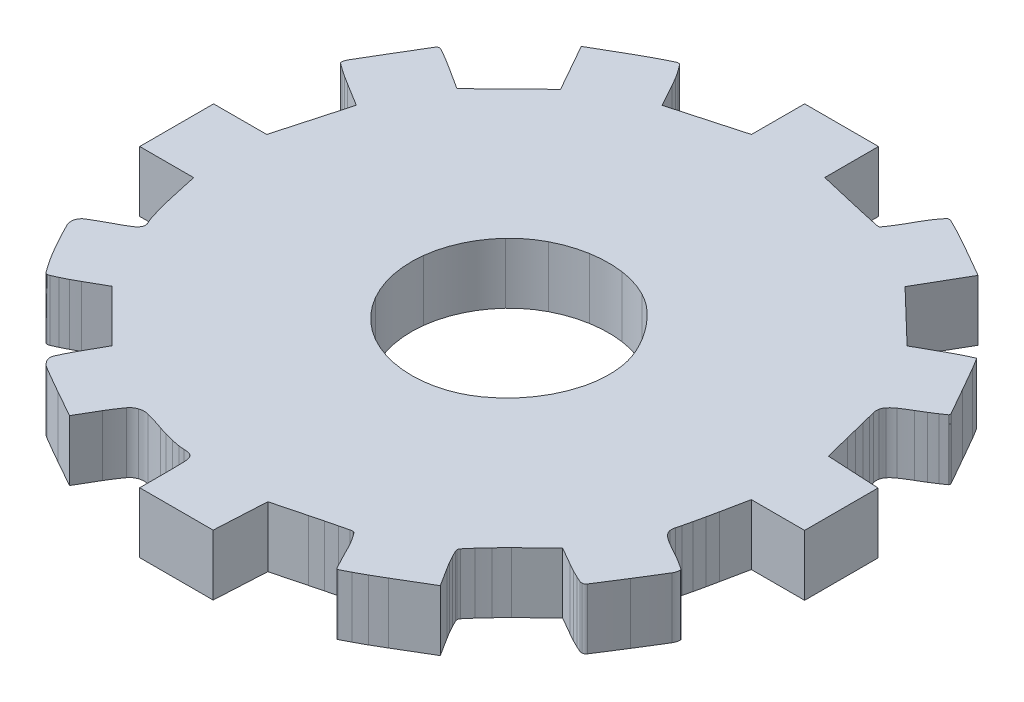
from build123d import *

# Parameters (mm, degrees)
BOSS_EXTRUDE1_DEPTH = 1
SCALE1_SCALE        = 18


with BuildPart() as part:
    # Sketch1 → Boss-Extrude1 (new body)
    with BuildSketch(Plane(origin=(0, 0, 0), x_dir=(1, 0, 0), z_dir=(0, 1, 0))):
        with BuildLine():
            Line((14951.934815684, 3224.873667402), (14951.934288838, 3224.435517402))
            Line((14951.934288838, 3224.435517402), (14951.357048235, 3224.275253181))
            Line((14951.357048235, 3224.275253181), (14950.779807631, 3224.11498896))
            Line((14950.779807631, 3224.11498896), (14950.576525081, 3224.483705292))
            ThreePointArc((14950.576525081, 3224.483705292), (14950.536206031, 3224.554865199), (14950.494241807, 3224.625067493))
            ThreePointArc((14950.494241807, 3224.625067493), (14950.455742563, 3224.685434793), (14950.415177449, 3224.744433726))
            ThreePointArc((14950.415177449, 3224.744433726), (14950.380816699, 3224.791350253), (14950.345294048, 3224.837393307))
            ThreePointArc((14950.345294048, 3224.837393307), (14950.330815109, 3224.849111812), (14950.312717176, 3224.853519513))
            ThreePointArc((14950.312717176, 3224.853519513), (14950.291892949, 3224.851425913), (14950.272140143, 3224.844507948))
            ThreePointArc((14950.272140143, 3224.844507948), (14950.198863614, 3224.808265842), (14950.125886435, 3224.771424681))
            ThreePointArc((14950.125886435, 3224.771424681), (14950.039615247, 3224.726613358), (14949.954022669, 3224.680519071))
            ThreePointArc((14949.954022669, 3224.680519071), (14949.857580123, 3224.627005112), (14949.761690821, 3224.572506029))
            Line((14949.761690821, 3224.572506029), (14949.271189897, 3224.290394655))
            Line((14949.271189897, 3224.290394655), (14949.49274955, 3223.897812636))
            Line((14949.49274955, 3223.897812636), (14949.714309127, 3223.505230541))
            Line((14949.714309127, 3223.505230541), (14949.281775829, 3223.082790466))
            Line((14949.281775829, 3223.082790466), (14948.849242531, 3222.660350315))
            Line((14948.849242531, 3222.660350315), (14948.506342531, 3222.879744898))
            ThreePointArc((14948.506342531, 3222.879744898), (14948.439364248, 3222.92215023), (14948.371984558, 3222.963914808))
            ThreePointArc((14948.371984558, 3222.963914808), (14948.312316169, 3222.999934458), (14948.252149237, 3223.035115022))
            ThreePointArc((14948.252149237, 3223.035115022), (14948.20110897, 3223.06423282), (14948.149856528, 3223.09297551))
            ThreePointArc((14948.149856528, 3223.09297551), (14948.136640581, 3223.098398183), (14948.12252275, 3223.100578442))
            ThreePointArc((14948.12252275, 3223.100578442), (14948.097800986, 3223.094773131), (14948.079433631, 3223.077237239))
            ThreePointArc((14948.079433631, 3223.077237239), (14947.941477447, 3222.847879973), (14947.804090951, 3222.618181007))
            ThreePointArc((14947.804090951, 3222.618181007), (14947.671209776, 3222.394338), (14947.539254651, 3222.169947842))
            ThreePointArc((14947.539254651, 3222.169947842), (14947.521724795, 3222.128153776), (14947.515742531, 3222.083228813))
            ThreePointArc((14947.515742531, 3222.083228813), (14947.518456442, 3222.071834682), (14947.526015358, 3222.062887375))
            ThreePointArc((14947.526015358, 3222.062887375), (14947.575079119, 3222.02704536), (14947.624468349, 3221.991653177))
            ThreePointArc((14947.624468349, 3221.991653177), (14947.683830394, 3221.950410107), (14947.744005346, 3221.910362407))
            ThreePointArc((14947.744005346, 3221.910362407), (14947.814651655, 3221.864999938), (14947.885873058, 3221.820545848))
            Line((14947.885873058, 3221.820545848), (14948.256003509, 3221.59280226))
            Line((14948.256003509, 3221.59280226), (14948.095423058, 3221.014436716))
            Line((14948.095423058, 3221.014436716), (14947.934842531, 3220.436071096))
            Line((14947.934842531, 3220.436071096), (14947.496692531, 3220.435544249))
            Line((14947.496692531, 3220.435544249), (14947.058542531, 3220.435017402))
            Line((14947.058542531, 3220.435017402), (14947.058542531, 3219.825417402))
            Line((14947.058542531, 3219.825417402), (14947.058542531, 3219.215817402))
            Line((14947.058542531, 3219.215817402), (14947.503616825, 3219.215817402))
            Line((14947.503616825, 3219.215817402), (14947.948691119, 3219.215817402))
            Line((14947.948691119, 3219.215817402), (14948.045749879, 3218.777667402))
            ThreePointArc((14948.045749879, 3218.777667402), (14948.06616249, 3218.688824183), (14948.087965745, 3218.600311979))
            ThreePointArc((14948.087965745, 3218.600311979), (14948.110521759, 3218.514818592), (14948.134543453, 3218.429725401))
            ThreePointArc((14948.134543453, 3218.429725401), (14948.156282595, 3218.357367129), (14948.1791949, 3218.28537174))
            ThreePointArc((14948.1791949, 3218.28537174), (14948.193847543, 3218.246231799), (14948.211730547, 3218.208458355))
            ThreePointArc((14948.211730547, 3218.208458355), (14948.225367279, 3218.173107775), (14948.230512857, 3218.135569169))
            ThreePointArc((14948.230512857, 3218.135569169), (14948.225570245, 3218.102675431), (14948.209976195, 3218.073294262))
            ThreePointArc((14948.209976195, 3218.073294262), (14948.177770194, 3218.038464444), (14948.139909761, 3218.009882451))
            ThreePointArc((14948.139909761, 3218.009882451), (14948.067433046, 3217.966457249), (14947.993447494, 3217.925655771))
            ThreePointArc((14947.993447494, 3217.925655771), (14947.818723411, 3217.830651355), (14947.64632129, 3217.731495657))
            ThreePointArc((14947.64632129, 3217.731495657), (14947.596478829, 3217.687216496), (14947.566909688, 3217.627462159))
            ThreePointArc((14947.566909688, 3217.627462159), (14947.561267534, 3217.560048582), (14947.580197292, 3217.495101768))
            ThreePointArc((14947.580197292, 3217.495101768), (14947.675763054, 3217.310568956), (14947.775250013, 3217.128120282))
            ThreePointArc((14947.775250013, 3217.128120282), (14947.830621055, 3217.031201193), (14947.887757256, 3216.935312108))
            ThreePointArc((14947.887757256, 3216.935312108), (14947.939220274, 3216.853321798), (14947.992957757, 3216.772803873))
            ThreePointArc((14947.992957757, 3216.772803873), (14948.038646058, 3216.707566634), (14948.085430267, 3216.643110788))
            ThreePointArc((14948.085430267, 3216.643110788), (14948.101209246, 3216.6297969), (14948.121293873, 3216.625017402))
            ThreePointArc((14948.121293873, 3216.625017402), (14948.141814103, 3216.627125585), (14948.161477029, 3216.633362064))
            ThreePointArc((14948.161477029, 3216.633362064), (14948.211691348, 3216.655640637), (14948.261539668, 3216.678726515))
            ThreePointArc((14948.261539668, 3216.678726515), (14948.321022555, 3216.707643012), (14948.379872477, 3216.737826854))
            ThreePointArc((14948.379872477, 3216.737826854), (14948.444156564, 3216.772330796), (14948.50788139, 3216.807857016))
            Line((14948.50788139, 3216.807857016), (14948.829776327, 3216.990696707))
            Line((14948.829776327, 3216.990696707), (14949.254426201, 3216.566046832))
            Line((14949.254426201, 3216.566046832), (14949.679076076, 3216.141396957))
            Line((14949.679076076, 3216.141396957), (14949.477284227, 3215.779970451))
            ThreePointArc((14949.477284227, 3215.779970451), (14949.408184726, 3215.648932998), (14949.345436205, 3215.514738444))
            ThreePointArc((14949.345436205, 3215.514738444), (14949.334074379, 3215.453412233), (14949.351150138, 3215.393425454))
            ThreePointArc((14949.351150138, 3215.393425454), (14949.395651288, 3215.333559955), (14949.454200046, 3215.287340118))
            ThreePointArc((14949.454200046, 3215.287340118), (14949.672387062, 3215.159368164), (14949.892132572, 3215.034091247))
            Line((14949.892132572, 3215.034091247), (14950.325422688, 3214.790593842))
            Line((14950.325422688, 3214.790593842), (14950.528023248, 3215.136305622))
            ThreePointArc((14950.528023248, 3215.136305622), (14950.602816566, 3215.256833017), (14950.683610846, 3215.373422801))
            ThreePointArc((14950.683610846, 3215.373422801), (14950.734983199, 3215.42446894), (14950.799628623, 3215.457115471))
            ThreePointArc((14950.799628623, 3215.457115471), (14950.873858162, 3215.46967157), (14950.948618368, 3215.46080637))
            ThreePointArc((14950.948618368, 3215.46080637), (14951.099992349, 3215.417209739), (14951.249542531, 3215.367717402))
            ThreePointArc((14951.249542531, 3215.367717402), (14951.317858019, 3215.344786398), (14951.38684472, 3215.32396161))
            ThreePointArc((14951.38684472, 3215.32396161), (14951.45890978, 3215.304479373), (14951.53148497, 3215.286993027))
            ThreePointArc((14951.53148497, 3215.286993027), (14951.597079518, 3215.273103839), (14951.66303665, 3215.261053481))
            ThreePointArc((14951.66303665, 3215.261053481), (14951.70857055, 3215.255329718), (14951.754422929, 3215.253417402))
            ThreePointArc((14951.754422929, 3215.253417402), (14951.806126607, 3215.249109792), (14951.856404665, 3215.236305778))
            ThreePointArc((14951.856404665, 3215.236305778), (14951.888057377, 3215.216992333), (14951.908754218, 3215.186226376))
            ThreePointArc((14951.908754218, 3215.186226376), (14951.924614851, 3215.133108571), (14951.931079751, 3215.078051637))
            ThreePointArc((14951.931079751, 3215.078051637), (14951.934276756, 3214.937150637), (14951.935342531, 3214.796217402))
            Line((14951.935342531, 3214.796217402), (14951.935342531, 3214.339017402))
            Line((14951.935342531, 3214.339017402), (14952.541139846, 3214.339017402))
            Line((14952.541139846, 3214.339017402), (14953.146937162, 3214.339017402))
            Line((14953.146937162, 3214.339017402), (14953.169789846, 3214.767500137))
            Line((14953.169789846, 3214.767500137), (14953.192642531, 3215.195982872))
            Line((14953.192642531, 3215.195982872), (14953.726042531, 3215.334607512))
            ThreePointArc((14953.726042531, 3215.334607512), (14953.83020187, 3215.361494781), (14953.934448998, 3215.388039638))
            ThreePointArc((14953.934448998, 3215.388039638), (14954.026714796, 3215.411139538), (14954.119089142, 3215.433801471))
            ThreePointArc((14954.119089142, 3215.433801471), (14954.197444941, 3215.452725557), (14954.275846943, 3215.471457302))
            ThreePointArc((14954.275846943, 3215.471457302), (14954.295326256, 3215.475298206), (14954.315043842, 3215.477624777))
            ThreePointArc((14954.315043842, 3215.477624777), (14954.331310855, 3215.474869962), (14954.344335046, 3215.464742024))
            ThreePointArc((14954.344335046, 3215.464742024), (14954.373928761, 3215.425621705), (14954.402286137, 3215.385596132))
            ThreePointArc((14954.402286137, 3215.385596132), (14954.435859635, 3215.334426144), (14954.467348135, 3215.281947368))
            ThreePointArc((14954.467348135, 3215.281947368), (14954.501478182, 3215.220500789), (14954.533960347, 3215.158167402))
            ThreePointArc((14954.533960347, 3215.158167402), (14954.565937506, 3215.095111128), (14954.59819847, 3215.032199582))
            ThreePointArc((14954.59819847, 3215.032199582), (14954.626932374, 3214.976922279), (14954.656028936, 3214.921835007))
            ThreePointArc((14954.656028936, 3214.921835007), (14954.680952167, 3214.875205185), (14954.706027186, 3214.828656809))
            ThreePointArc((14954.706027186, 3214.828656809), (14954.712524169, 3214.818124633), (14954.720176763, 3214.808399649))
            ThreePointArc((14954.720176763, 3214.808399649), (14954.729694156, 3214.802980317), (14954.740537099, 3214.804523202))
            ThreePointArc((14954.740537099, 3214.804523202), (14954.817272284, 3214.843856596), (14954.893783376, 3214.883624136))
            ThreePointArc((14954.893783376, 3214.883624136), (14954.983242336, 3214.931401768), (14955.071889217, 3214.980669789))
            ThreePointArc((14955.071889217, 3214.980669789), (14955.175760787, 3215.040245224), (14955.279018572, 3215.100878261))
            Line((14955.279018572, 3215.100878261), (14955.814959156, 3215.419274703))
            Line((14955.814959156, 3215.419274703), (14955.627750844, 3215.715831768))
            ThreePointArc((14955.627750844, 3215.715831768), (14955.591388985, 3215.774549788), (14955.556046415, 3215.833886904))
            ThreePointArc((14955.556046415, 3215.833886904), (14955.525154359, 3215.888227696), (14955.495535005, 3215.943272538))
            ThreePointArc((14955.495535005, 3215.943272538), (14955.47191462, 3215.989404245), (14955.449110307, 3216.035944768))
            ThreePointArc((14955.449110307, 3216.035944768), (14955.442711433, 3216.054319947), (14955.440542531, 3216.073656148))
            ThreePointArc((14955.440542531, 3216.073656148), (14955.444148234, 3216.094023562), (14955.45452706, 3216.111915254))
            ThreePointArc((14955.45452706, 3216.111915254), (14955.509135183, 3216.1759021), (14955.564457905, 3216.239272124))
            ThreePointArc((14955.564457905, 3216.239272124), (14955.63183615, 3216.314023902), (14955.700733222, 3216.387378177))
            ThreePointArc((14955.700733222, 3216.387378177), (14955.780994939, 3216.469953823), (14955.86238215, 3216.551420394))
            Line((14955.86238215, 3216.551420394), (14956.284221692, 3216.967917402))
            Line((14956.284221692, 3216.967917402), (14956.582328741, 3216.796467402))
            ThreePointArc((14956.582328741, 3216.796467402), (14956.641479628, 3216.763123038), (14956.701196474, 3216.730803195))
            ThreePointArc((14956.701196474, 3216.730803195), (14956.756162857, 3216.702461874), (14956.811760998, 3216.675380878))
            ThreePointArc((14956.811760998, 3216.675380878), (14956.858362364, 3216.653841484), (14956.905340008, 3216.633135598))
            ThreePointArc((14956.905340008, 3216.633135598), (14956.924634599, 3216.627068032), (14956.944756515, 3216.625017402))
            ThreePointArc((14956.944756515, 3216.625017402), (14956.97859725, 3216.633649157), (14957.004169198, 3216.657435245))
            ThreePointArc((14957.004169198, 3216.657435245), (14957.142804494, 3216.874000472), (14957.280399989, 3217.091227824))
            ThreePointArc((14957.280399989, 3217.091227824), (14957.412929306, 3217.303281711), (14957.543907972, 3217.516296875))
            ThreePointArc((14957.543907972, 3217.516296875), (14957.566440411, 3217.568036102), (14957.574142531, 3217.623940805))
            ThreePointArc((14957.574142531, 3217.623940805), (14957.571498264, 3217.634505435), (14957.564189059, 3217.642578791))
            ThreePointArc((14957.564189059, 3217.642578791), (14957.518410727, 3217.672878765), (14957.472325844, 3217.702710421))
            ThreePointArc((14957.472325844, 3217.702710421), (14957.416723008, 3217.737466262), (14957.360386596, 3217.771019987))
            ThreePointArc((14957.360386596, 3217.771019987), (14957.294215965, 3217.808869942), (14957.227532506, 3217.845808916))
            ThreePointArc((14957.227532506, 3217.845808916), (14957.137919447, 3217.896497691), (14957.049948634, 3217.949985898))
            ThreePointArc((14957.049948634, 3217.949985898), (14957.00167801, 3217.985457216), (14956.958969416, 3218.027460114))
            ThreePointArc((14956.958969416, 3218.027460114), (14956.935791064, 3218.062142517), (14956.922539034, 3218.101696136))
            ThreePointArc((14956.922539034, 3218.101696136), (14956.919548722, 3218.14467387), (14956.926936155, 3218.187117402))
            ThreePointArc((14956.926936155, 3218.187117402), (14956.939167669, 3218.229775984), (14956.950201386, 3218.272759954))
            ThreePointArc((14956.950201386, 3218.272759954), (14956.968175324, 3218.3480557), (14956.985703652, 3218.423456427))
            ThreePointArc((14956.985703652, 3218.423456427), (14957.005506306, 3218.511040684), (14957.024766439, 3218.59874584))
            ThreePointArc((14957.024766439, 3218.59874584), (14957.04383594, 3218.68815146), (14957.062380664, 3218.777667402))
            Line((14957.062380664, 3218.777667402), (14957.151811575, 3219.215817402))
            Line((14957.151811575, 3219.215817402), (14957.591577015, 3219.215817402))
            Line((14957.591577015, 3219.215817402), (14958.031342531, 3219.215817402))
            Line((14958.031342531, 3219.215817402), (14958.031342531, 3219.821614718))
            Line((14958.031342531, 3219.821614718), (14958.031342531, 3220.427412033))
            Line((14958.031342531, 3220.427412033), (14957.598641517, 3220.450264718))
            Line((14957.598641517, 3220.450264718), (14957.165940503, 3220.473117402))
            Line((14957.165940503, 3220.473117402), (14957.061376958, 3220.892217402))
            Line((14957.061376958, 3220.892217402), (14957.01833935, 3221.064423078))
            Line((14957.01833935, 3221.064423078), (14956.975491404, 3221.235282375))
            Line((14956.975491404, 3221.235282375), (14956.938170321, 3221.383596989))
            ThreePointArc((14956.938170321, 3221.383596989), (14956.927040115, 3221.427595459), (14956.915834424, 3221.471574765))
            ThreePointArc((14956.915834424, 3221.471574765), (14956.909705996, 3221.516539231), (14956.913979259, 3221.561717765))
            ThreePointArc((14956.913979259, 3221.561717765), (14956.928440028, 3221.603617398), (14956.952679487, 3221.640727259))
            ThreePointArc((14956.952679487, 3221.640727259), (14956.996299166, 3221.685655491), (14957.045674881, 3221.724168621))
            ThreePointArc((14957.045674881, 3221.724168621), (14957.134193872, 3221.781871462), (14957.224498984, 3221.8367369))
            ThreePointArc((14957.224498984, 3221.8367369), (14957.291746342, 3221.876677676), (14957.358520991, 3221.91740382))
            ThreePointArc((14957.358520991, 3221.91740382), (14957.415313309, 3221.953228313), (14957.471434761, 3221.990094887))
            ThreePointArc((14957.471434761, 3221.990094887), (14957.518441109, 3222.021862786), (14957.565200233, 3222.053993463))
            ThreePointArc((14957.565200233, 3222.053993463), (14957.571771652, 3222.061430892), (14957.574142531, 3222.071068207))
            ThreePointArc((14957.574142531, 3222.071068207), (14957.572141629, 3222.086493085), (14957.566271376, 3222.100896926))
            Line((14957.566271376, 3222.100896926), (14957.323225761, 3222.528838335))
            ThreePointArc((14957.323225761, 3222.528838335), (14957.213801688, 3222.720531215), (14957.103741034, 3222.911859312))
            ThreePointArc((14957.103741034, 3222.911859312), (14957.051089311, 3223.000376421), (14956.996167741, 3223.08750336))
            ThreePointArc((14956.996167741, 3223.08750336), (14956.989389062, 3223.092548988), (14956.980960126, 3223.09194742))
            ThreePointArc((14956.980960126, 3223.09194742), (14956.928689636, 3223.067914211), (14956.876620761, 3223.043447263))
            ThreePointArc((14956.876620761, 3223.043447263), (14956.814854871, 3223.013330424), (14956.753718848, 3222.981954701))
            ThreePointArc((14956.753718848, 3222.981954701), (14956.681959179, 3222.943623098), (14956.610680399, 3222.904404513))
            Line((14956.610680399, 3222.904404513), (14956.240490131, 3222.69771971))
            Line((14956.240490131, 3222.69771971), (14955.808362979, 3223.11292467))
            Line((14955.808362979, 3223.11292467), (14955.376235903, 3223.528129555))
            Line((14955.376235903, 3223.528129555), (14955.596576509, 3223.909773445))
            Line((14955.596576509, 3223.909773445), (14955.816917115, 3224.291417259))
            Line((14955.816917115, 3224.291417259), (14955.327305216, 3224.573017331))
            ThreePointArc((14955.327305216, 3224.573017331), (14955.231528656, 3224.627454645), (14955.135201511, 3224.680911654))
            ThreePointArc((14955.135201511, 3224.680911654), (14955.049572412, 3224.727040734), (14954.963269927, 3224.771897349))
            ThreePointArc((14954.963269927, 3224.771897349), (14954.890311863, 3224.808755032), (14954.817051195, 3224.845007516))
            ThreePointArc((14954.817051195, 3224.845007516), (14954.79686321, 3224.852183529), (14954.775576449, 3224.854617402))
            ThreePointArc((14954.775576449, 3224.854617402), (14954.757332966, 3224.8505265), (14954.742583145, 3224.839037246))
            ThreePointArc((14954.742583145, 3224.839037246), (14954.708998799, 3224.796954421), (14954.676682032, 3224.753890527))
            ThreePointArc((14954.676682032, 3224.753890527), (14954.638488611, 3224.699208334), (14954.602422922, 3224.643099995))
            ThreePointArc((14954.602422922, 3224.643099995), (14954.563426966, 3224.577905551), (14954.526142531, 3224.511717402))
            ThreePointArc((14954.526142531, 3224.511717402), (14954.489352217, 3224.445666098), (14954.451480933, 3224.380228587))
            ThreePointArc((14954.451480933, 3224.380228587), (14954.417537842, 3224.324304585), (14954.382190521, 3224.269257384))
            ThreePointArc((14954.382190521, 3224.269257384), (14954.352022776, 3224.224251872), (14954.321223662, 3224.179676055))
            ThreePointArc((14954.321223662, 3224.179676055), (14954.311587125, 3224.171129979), (14954.299134044, 3224.167840747))
            ThreePointArc((14954.299134044, 3224.167840747), (14954.284421694, 3224.168339755), (14954.269868215, 3224.17055301))
            ThreePointArc((14954.269868215, 3224.17055301), (14954.189327411, 3224.187752384), (14954.108819744, 3224.205106205))
            ThreePointArc((14954.108819744, 3224.205106205), (14954.015148861, 3224.22563468), (14953.921580951, 3224.246627508))
            ThreePointArc((14953.921580951, 3224.246627508), (14953.814246146, 3224.271174269), (14953.706992531, 3224.296073384))
            Line((14953.706992531, 3224.296073384), (14953.154542531, 3224.425282752))
            Line((14953.154542531, 3224.425282752), (14953.154542531, 3224.868550115))
            Line((14953.154542531, 3224.868550115), (14953.154542531, 3225.311817402))
            Line((14953.154542531, 3225.311817402), (14952.544942531, 3225.311817402))
            Line((14952.544942531, 3225.311817402), (14951.935342531, 3225.311817402))
            Line((14951.935342531, 3225.311817402), (14951.934815684, 3224.873667402))
        make_face()
        with BuildLine():
            ThreePointArc((14953.603172698, 3221.044096118), (14953.465602836, 3221.156816865), (14953.31400749, 3221.249823774))
            ThreePointArc((14953.31400749, 3221.249823774), (14953.077922348, 3221.348592617), (14952.828416361, 3221.405498164))
            ThreePointArc((14952.828416361, 3221.405498164), (14952.563123984, 3221.42181059), (14952.298460525, 3221.397328076))
            ThreePointArc((14952.298460525, 3221.397328076), (14952.040353954, 3221.332577832), (14951.795177432, 3221.229136693))
            ThreePointArc((14951.795177432, 3221.229136693), (14951.577862867, 3221.092478796), (14951.386934789, 3220.920876146))
            ThreePointArc((14951.386934789, 3220.920876146), (14951.099001749, 3220.49501713), (14950.958403972, 3220.000554187))
            ThreePointArc((14950.958403972, 3220.000554187), (14950.97942863, 3219.487479445), (14951.160056604, 3219.006791125))
            ThreePointArc((14951.160056604, 3219.006791125), (14951.482348013, 3218.606338822), (14951.913679405, 3218.326719384))
            ThreePointArc((14951.913679405, 3218.326719384), (14952.411526991, 3218.195374222), (14952.925528384, 3218.225479683))
            ThreePointArc((14952.925528384, 3218.225479683), (14953.207742759, 3218.318129374), (14953.465784022, 3218.465247098))
            ThreePointArc((14953.465784022, 3218.465247098), (14953.701120012, 3218.666487207), (14953.897196951, 3218.90614205))
            ThreePointArc((14953.897196951, 3218.90614205), (14954.047956321, 3219.17682942), (14954.148555224, 3219.469882147))
            ThreePointArc((14954.148555224, 3219.469882147), (14954.190601675, 3219.764395965), (14954.173225432, 3220.061388152))
            ThreePointArc((14954.173225432, 3220.061388152), (14954.133357715, 3220.233388397), (14954.070141538, 3220.398243587))
            ThreePointArc((14954.070141538, 3220.398243587), (14953.977176528, 3220.575501022), (14953.867765311, 3220.743107337))
            ThreePointArc((14953.867765311, 3220.743107337), (14953.742634193, 3220.899900487), (14953.603172698, 3221.044096118))
        make_face(mode=Mode.SUBTRACT)
    extrude(amount=BOSS_EXTRUDE1_DEPTH)


with BuildPart() as part_1:
    # Scale1: scaled about (14952.551102627, 0.5, -3219.827797332)
    add(part.part.scale(SCALE1_SCALE).moved(Location((-254193.368744659, -8.5, 54737.072554644))))


solid = part_1.part
